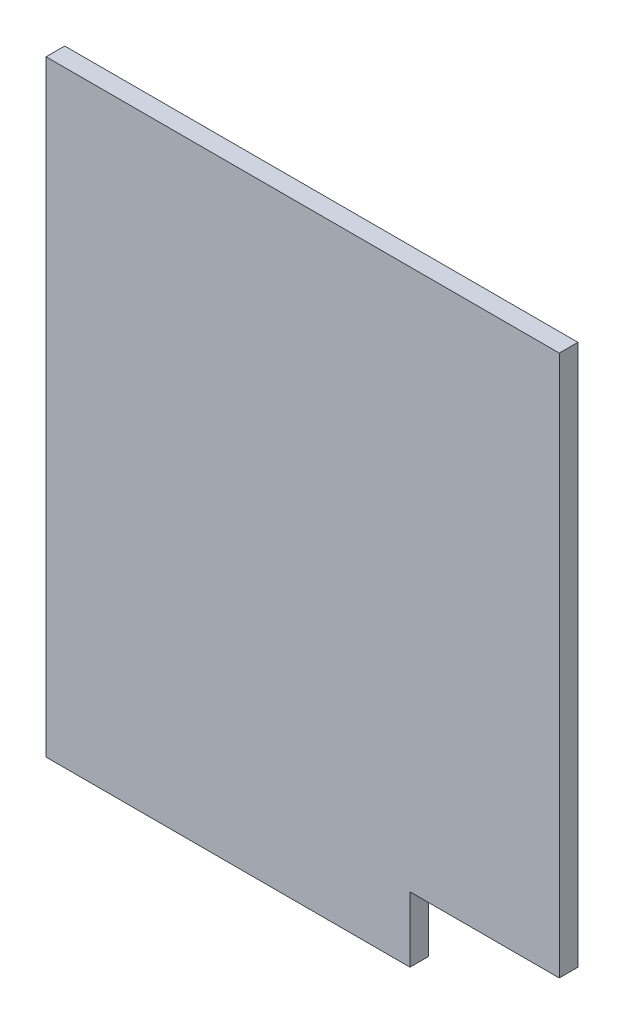
from build123d import *

# Parameters (mm, degrees)
SKETCH_1_W          = 55
SKETCH_1_H          = 65
EXTRUDE_1_DEPTH     = 2
SKETCH_2_W          = 16
SKETCH_2_H          = 7
CUT_EXTRUDE_2_DEPTH = 2


with BuildPart() as part:
    # 草图1 → 凸台-拉伸1 (new body)
    with BuildSketch(Plane.XY):
        Rectangle(SKETCH_1_W, SKETCH_1_H)
    extrude(amount=EXTRUDE_1_DEPTH)

    # 草图2 → 切除-拉伸2 (cut)
    with BuildSketch(Plane.XY.offset(2)):
        with Locations((19.5, -29)):
            Rectangle(SKETCH_2_W, SKETCH_2_H)
    extrude(amount=-CUT_EXTRUDE_2_DEPTH, mode=Mode.SUBTRACT)


solid = part.part
